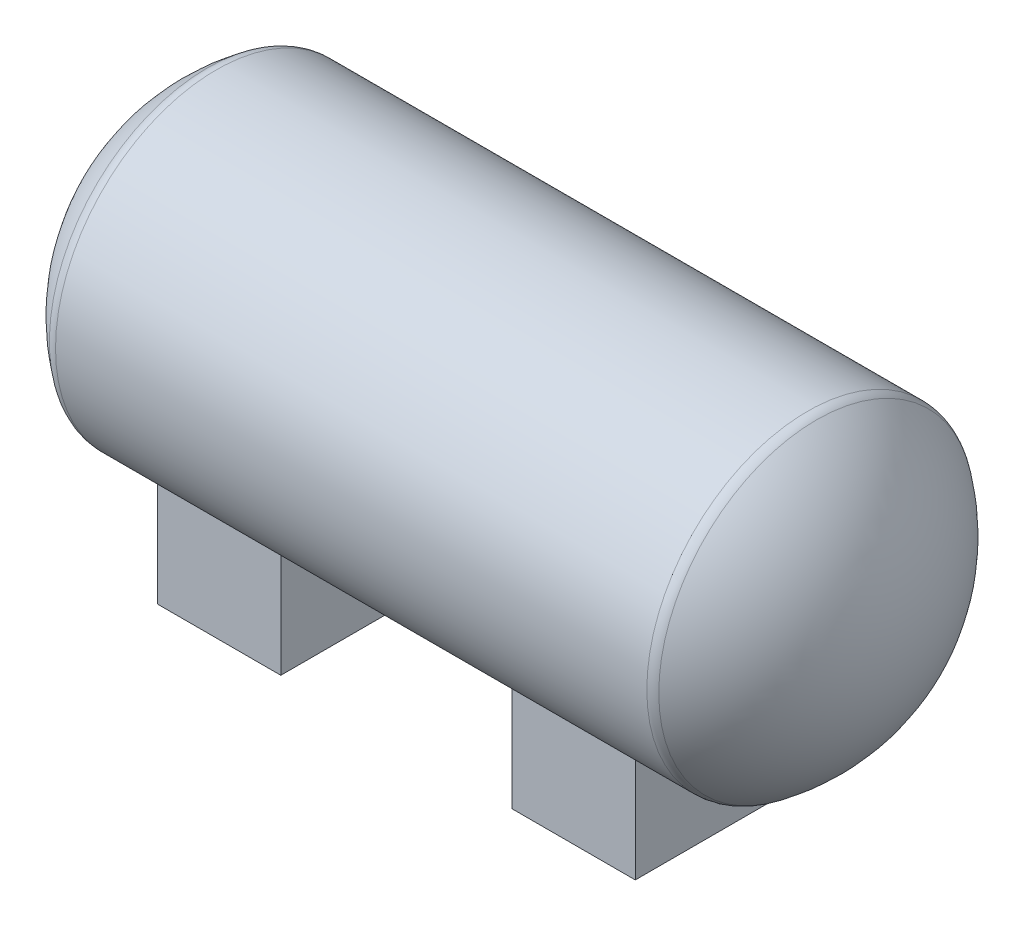
from build123d import *

# Parameters (mm, degrees)
SKETCH_3_W          = 8
SKETCH_3_H          = 15
EXTRUDE_1_DEPTH     = 14
SKETCH_4_R          = 1.5
CUT_EXTRUDE_1_DEPTH = 10
FILLET_1_R          = 1


with BuildPart() as part:
    # ｽｹｯﾁ1 → 回転2 (revolve)
    with BuildSketch(Plane.XY):
        with BuildLine():
            Line((-19.5, 10.435516279), (19.5, 10.435516279))
            ThreePointArc((19.5, 10.435516279), (23.540844472, 5.898092912), (25, 0))
            Line((25, 0), (-25, 0))
            ThreePointArc((-25, 0), (-23.540844472, 5.898092912), (-19.5, 10.435516279))
        make_face()
    revolve(axis=Axis((-19.5, 0, 0), (1, 0, 0)))

    # ｽｹｯﾁ3 → ﾎﾞｽ - 押し出し1 (add)
    with BuildSketch(Plane(origin=(0, 0, 0), x_dir=(1, 0, 0), z_dir=(0, 1, 0))):
        with Locations((-11.5, 0)):
            Rectangle(SKETCH_3_W, SKETCH_3_H)
        with Locations((11.5, 0)):
            Rectangle(SKETCH_3_W, SKETCH_3_H)
    extrude(amount=-EXTRUDE_1_DEPTH)

    # ｽｹｯﾁ4 → ｶｯﾄ - 押し出し1 (cut)
    with BuildSketch(Plane(origin=(0, -14, 0), x_dir=(-1, 0, 0), z_dir=(0, -1, 0))):
        with Locations(Location((-11.5, 0, 0), (0, 0, 90))):
            Circle(SKETCH_4_R)
        with Locations(Location((11.5, 0, 0), (0, 0, 90))):
            Circle(SKETCH_4_R)
    extrude(amount=-CUT_EXTRUDE_1_DEPTH, mode=Mode.SUBTRACT)

    # ﾌｨﾚｯﾄ1
    fillet_1_edges = [part.edges().sort_by_distance(p)[0] for p in [
        (-19.5, -10.435516279, 0),
        (19.5, -10.435516279, 0),
    ]]
    fillet(fillet_1_edges, radius=FILLET_1_R)


solid = part.part
